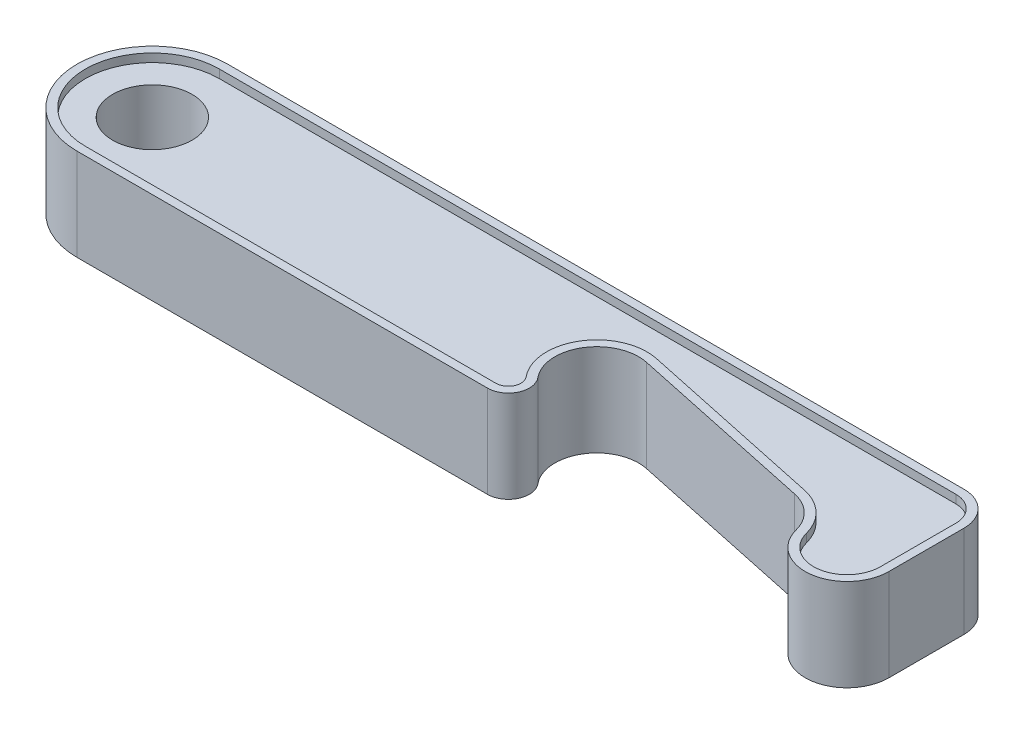
from build123d import *

# Parameters (mm, degrees)
SZKIC1_R                    = 4.75
DODANIE_WYCI_GNI_CIE1_DEPTH = 9
DODANIE_WYCI_GNI_CIE2_DEPTH = 1
DODANIE_WYCI_GNI_CIE3_START = 1
DODANIE_WYCI_GNI_CIE3_DEPTH = 1


with BuildPart() as part:
    # Szkic1 → Dodanie-wyciągnięcie1 (new body)
    with BuildSketch(Plane(origin=(0, 0, 0), x_dir=(1, 0, 0), z_dir=(0, 1, 0))):
        with BuildLine():
            Line((0, 9), (88, 9))
            ThreePointArc((88, 9), (90.828427125, 7.828427125), (92, 5))
            Line((92, 5), (92, -4))
            ThreePointArc((92, -4), (87.630021462, -8.960148481), (82.158770817, -5.25))
            ThreePointArc((82.158770817, -5.25), (80.775815642, -2.888858783), (78.357100089, -1.609261996))
            Line((78.357100089, -1.609261996), (55.857100089, 3.173260641))
            ThreePointArc((55.857100089, 3.173260641), (50.540307373, 0.871975682), (50.965992035, -4.905825787))
            ThreePointArc((50.965992035, -4.905825787), (51.302454571, -7.564087513), (49.040217235, -9))
            Line((49.040217235, -9), (0, -9))
            ThreePointArc((0, -9), (-9, 0), (0, 9))
        make_face()
        with Locations(Location((0, 0, 0), (0, 0, 270))):
            Circle(SZKIC1_R, mode=Mode.SUBTRACT)
    extrude(amount=DODANIE_WYCI_GNI_CIE1_DEPTH)

    # Szkic3 → Dodanie-wyciągnięcie2 (add)
    with BuildSketch(Plane(origin=(0, 9, 0), x_dir=(1, 0, 0), z_dir=(0, 1, 0))):
        with BuildLine():
            Line((92, -4), (92, 5))
            ThreePointArc((92, 5), (90.828427125, 7.828427125), (88, 9))
            Line((88, 9), (0, 9))
            ThreePointArc((0, 9), (-9, 0), (0, -9))
            Line((0, -9), (49.040217235, -9))
            ThreePointArc((49.040217235, -9), (51.302454571, -7.564087513), (50.965992035, -4.905825787))
            ThreePointArc((50.965992035, -4.905825787), (50.540307373, 0.871975682), (55.857100089, 3.173260641))
            Line((55.857100089, 3.173260641), (78.357100089, -1.609261996))
            ThreePointArc((78.357100089, -1.609261996), (80.775815642, -2.888858783), (82.158770817, -5.25))
            ThreePointArc((82.158770817, -5.25), (87.630021462, -8.960148481), (92, -4))
        make_face()
        with BuildLine():
            Line((0, -8), (49.040217235, -8))
            ThreePointArc((49.040217235, -8), (50.397559636, -7.138452508), (50.195682115, -5.543495472))
            ThreePointArc((50.195682115, -5.543495472), (49.68486052, 1.389866291), (56.065011779, 4.151408242))
            Line((56.065011779, 4.151408242), (78.565011779, -0.631114396))
            ThreePointArc((78.565011779, -0.631114396), (81.467470443, -2.166630539), (83.127016654, -5))
            ThreePointArc((83.127016654, -5), (87.50401717, -7.968118785), (91, -4))
            Line((91, -4), (91, 5))
            ThreePointArc((91, 5), (90.121320344, 7.121320344), (88, 8))
            Line((88, 8), (0, 8))
            ThreePointArc((0, 8), (-8, 0), (0, -8))
        make_face(mode=Mode.SUBTRACT)
    extrude(amount=DODANIE_WYCI_GNI_CIE2_DEPTH)

    # Szkic4 → Dodanie-wyciągnięcie3 (add)
    with BuildSketch(Plane.XZ.offset(DODANIE_WYCI_GNI_CIE3_START)):
        with BuildLine():
            Line((55.857100089, -3.173260641), (78.357100089, 1.609261996))
            ThreePointArc((78.357100089, 1.609261996), (80.775815642, 2.888858783), (82.158770817, 5.25))
            ThreePointArc((82.158770817, 5.25), (87.630021462, 8.960148481), (92, 4))
            Line((92, 4), (92, -5))
            ThreePointArc((92, -5), (90.828427125, -7.828427125), (88, -9))
            Line((88, -9), (0, -9))
            ThreePointArc((0, -9), (-9, 0), (0, 9))
            Line((0, 9), (49.040217235, 9))
            ThreePointArc((49.040217235, 9), (51.302454571, 7.564087513), (50.965992035, 4.905825787))
            ThreePointArc((50.965992035, 4.905825787), (50.540307373, -0.871975682), (55.857100089, -3.173260641))
        make_face()
        with BuildLine():
            Line((0, -8), (88, -8))
            ThreePointArc((88, -8), (90.121320344, -7.121320344), (91, -5))
            Line((91, -5), (91, 4))
            ThreePointArc((91, 4), (87.50401717, 7.968118785), (83.127016654, 5))
            ThreePointArc((83.127016654, 5), (81.467470443, 2.166630539), (78.565011779, 0.631114396))
            Line((78.565011779, 0.631114396), (56.065011779, -4.151408242))
            ThreePointArc((56.065011779, -4.151408242), (49.68486052, -1.389866291), (50.195682115, 5.543495472))
            ThreePointArc((50.195682115, 5.543495472), (50.397559636, 7.138452508), (49.040217235, 8))
            Line((49.040217235, 8), (0, 8))
            ThreePointArc((0, 8), (-8, 0), (0, -8))
        make_face(mode=Mode.SUBTRACT)
    extrude(amount=-DODANIE_WYCI_GNI_CIE3_DEPTH)


solid = part.part
